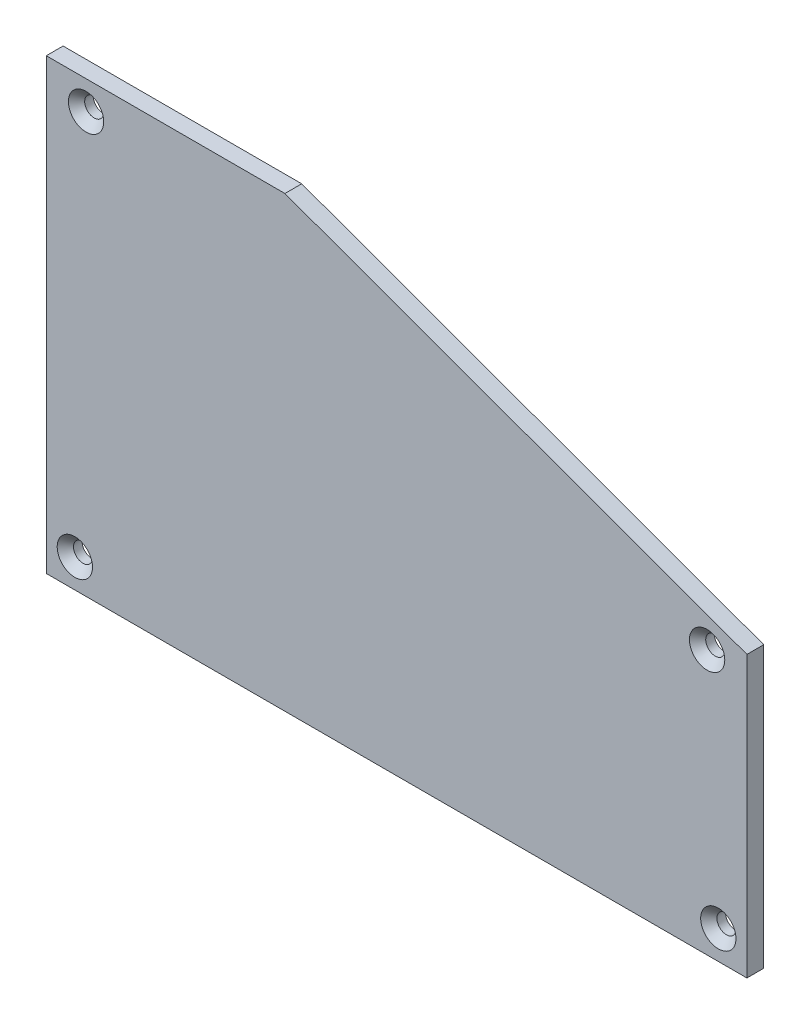
from build123d import *

# Parameters (mm, degrees)
EXTRUDE_1_DEPTH            = 3
HOLE_WIZARD_M31_AT_2_COUNT = 2
HOLE_WIZARD_M31_AT_2_PITCH = 69.828647416
HOLE_WIZARD_M31_AT_3_COUNT = 2
HOLE_WIZARD_M31_AT_3_PITCH = 114.220491135
HOLE_WIZARD_M31_AT_4_COUNT = 2
HOLE_WIZARD_M31_AT_4_PITCH = 132.649462871


with BuildPart() as part:
    # Эскиз1 → Бобышка-Вытянуть1 (new body)
    with BuildSketch(Plane.XY):
        Polygon((-19.924322584, 80), (62.5, 50), (62.5, 0), (-62.5, 0), (-62.5, 80), align=None)
    extrude(amount=EXTRUDE_1_DEPTH)

    # Эскиз5 → Зенковка для винта с потайной головкой M31 (revolve, cut)
    with BuildSketch(Plane(origin=(-55.4, 74.9, 3), x_dir=(0, -1, 0), z_dir=(1, 0, 0))):
        Polygon((0, 0), (0, 3), (1.7, 3), (1.7, 1.45), (3.15, 0), align=None)
    hole_wizard_m31 = revolve(axis=Axis((-55.4, 74.9, 9.35), (0, 0, -1)), mode=Mode.SUBTRACT)

    # Зенковка для винта с потайной головкой M31 at 2: Зенковка для винта с потайной головкой M31 ×2
    with Locations(*[Vector(-0.02864154002689579, -0.9995897469386568, 0) * (i * HOLE_WIZARD_M31_AT_2_PITCH) for i in range(1, HOLE_WIZARD_M31_AT_2_COUNT)]):
        add(hole_wizard_m31, mode=Mode.SUBTRACT)

    # Зенковка для винта с потайной головкой M31 at 3: Зенковка для винта с потайной головкой M31 ×2
    with Locations(*[Vector(0.9700536120909078, -0.24289090075460365, 0) * (i * HOLE_WIZARD_M31_AT_3_PITCH) for i in range(1, HOLE_WIZARD_M31_AT_3_COUNT)]):
        add(hole_wizard_m31, mode=Mode.SUBTRACT)

    # Зенковка для винта с потайной головкой M31 at 4: Зенковка для винта с потайной головкой M31 ×2
    with Locations(*[Vector(0.8503615284864274, -0.5261988890811409, 0) * (i * HOLE_WIZARD_M31_AT_4_PITCH) for i in range(1, HOLE_WIZARD_M31_AT_4_COUNT)]):
        add(hole_wizard_m31, mode=Mode.SUBTRACT)


solid = part.part
